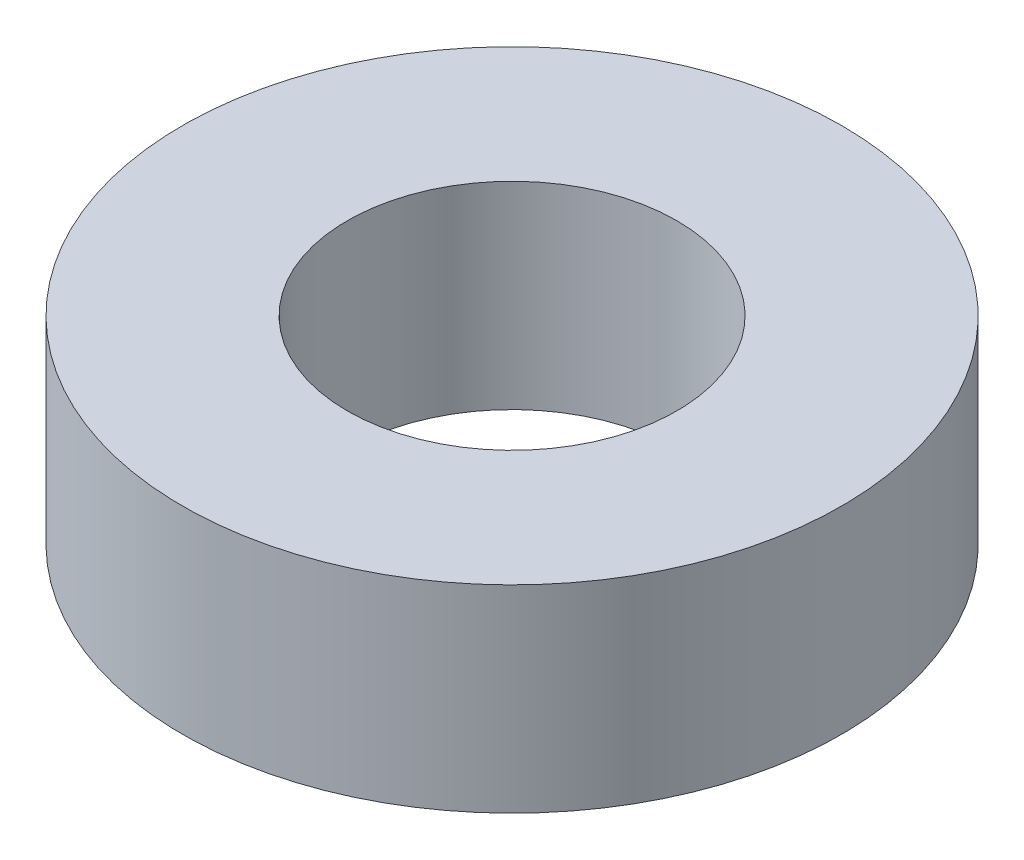
from build123d import *

# Parameters (mm, degrees)
SKETCH1_R           = 3.175
SKETCH1_R_2         = 1.5875
BOSS_EXTRUDE1_DEPTH = 1.905


with BuildPart() as part:
    # Sketch1 → Boss-Extrude1 (new body)
    with BuildSketch(Plane(origin=(0, 0, 0), x_dir=(1, 0, 0), z_dir=(0, 1, 0))):
        with Locations(Location((0, 0, 0), (0, 0, 90))):
            Circle(SKETCH1_R)
        with Locations(Location((0, 0, 0), (0, 0, 90))):
            Circle(SKETCH1_R_2, mode=Mode.SUBTRACT)
    extrude(amount=BOSS_EXTRUDE1_DEPTH)


solid = part.part
